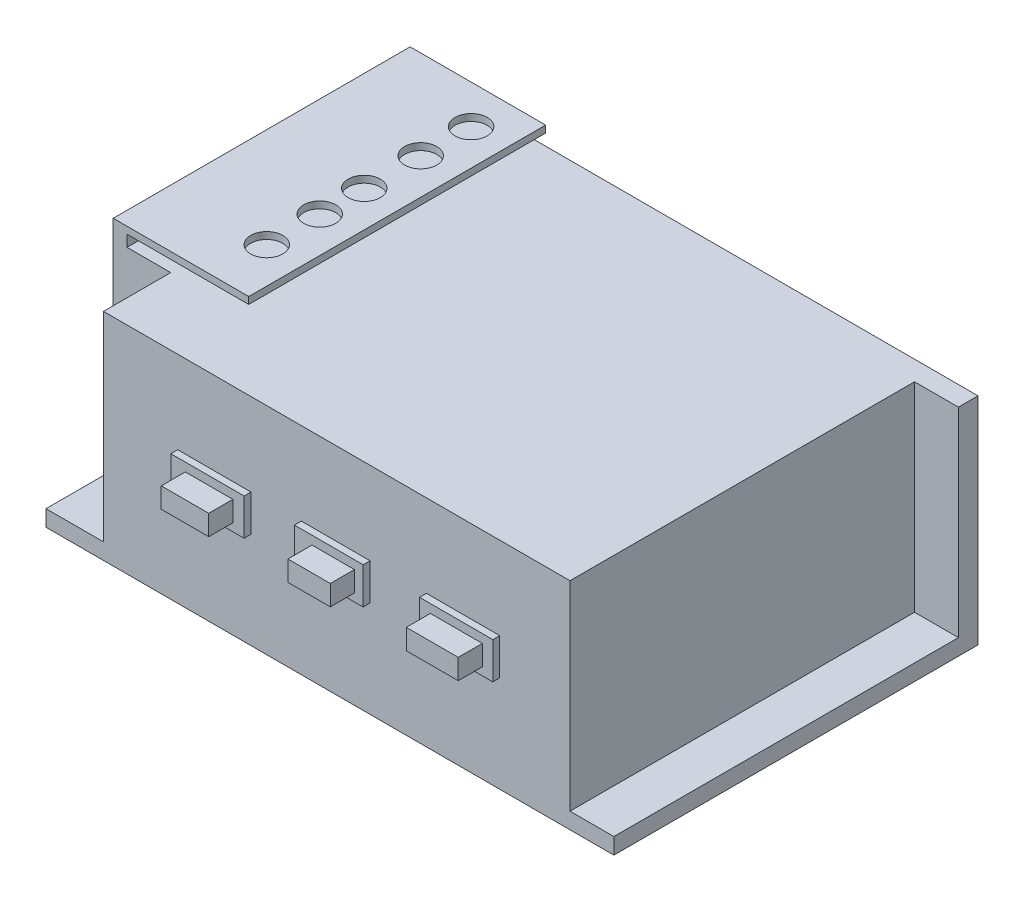
from build123d import *

# Parameters (mm, degrees)
SKETCH_1_W               = 165
SKETCH_1_H               = 68
EXTRUDE_1_DEPTH          = 105.8
SKETCH_2_W               = 39.381596793
SKETCH_2_H               = 19.528929346
SKETCH_2_W_2             = 20.130205532
CUT_EXTRUDE_1_DEPTH      = 2
SKETCH_3_R               = 4.669286721
CUT_EXTRUDE_2_DEPTH      = 2
SKETCH_4_W               = 21.280991735
SKETCH_4_H               = 10.640495868
SKETCH_4_W_2             = 19.950929752
EXTRUDE_2_DEPTH          = 2
SKETCH_5_W               = 13.799393078
SKETCH_5_H               = 5.887741047
SKETCH_5_W_2             = 12.327457817
SKETCH_5_W_3             = 15.087336432
EXTRUDE_3_DEPTH          = 7
SKETCH_6_W               = 105.8
SKETCH_6_H               = 3.312578262
CUT_EXTRUDE_3_DEPTH      = 161
CUT_EXTRUDE_4_DEPTH      = 58
CUT_EXTRUDE_4_DEPTH_BACK = 58
SKETCH_7_W               = 16.710317156
SKETCH_7_H               = 19.528929346
SKETCH_8_W               = 20.11053719
SKETCH_8_H               = 105.021694215
CUT_EXTRUDE_5_DEPTH      = 58


with BuildPart() as part:
    # 草图1 → 凸台-拉伸1 (new body)
    with BuildSketch(Plane.XY):
        Rectangle(SKETCH_1_W, SKETCH_1_H)
    extrude(amount=EXTRUDE_1_DEPTH)

    # 草图2 → 切除-拉伸1 (cut)
    with BuildSketch(Plane(origin=(0, 34, 0), x_dir=(1, 0, 0), z_dir=(0, 1, 0))):
        with Locations((-62.809201604, -96.035535327)):
            Rectangle(SKETCH_2_W, SKETCH_2_H)
        with Locations((-33.053300441, -96.035535327)):
            Rectangle(SKETCH_2_W_2, SKETCH_2_H)
        Polygon((82.5, 0), (-43.118403207, 0), (-43.118403207, -86.271070654), (-22.988197675, -86.271070654), (-22.988197675, -105.8), (82.5, -105.8), align=None)
    extrude(amount=-CUT_EXTRUDE_1_DEPTH, mode=Mode.SUBTRACT)

    # 草图3 → 切除-拉伸2 (cut)
    with BuildSketch(Plane(origin=(0, 34, 0), x_dir=(1, 0, 0), z_dir=(0, 1, 0))):
        with Locations(Location((-53.556287556, -11.217711758, 0), (0, 0, 270))):
            Circle(SKETCH_3_R)
        with Locations(Location((-53.556287556, -25.880454059, 0), (0, 0, 270))):
            Circle(SKETCH_3_R)
        with Locations(Location((-53.556287556, -42.282843752, 0), (0, 0, 270))):
            Circle(SKETCH_3_R)
        with Locations(Location((-53.556287556, -55.205938661, 0), (0, 0, 270))):
            Circle(SKETCH_3_R)
        with Locations(Location((-53.556287556, -70.61424413, 0), (0, 0, 270))):
            Circle(SKETCH_3_R)
    extrude(amount=-CUT_EXTRUDE_2_DEPTH, mode=Mode.SUBTRACT)

    # 草图4 → 凸台-拉伸2 (add)
    with BuildSketch(Plane.XY.offset(105.8)):
        with Locations((-33.584065083, -0.665030992)):
            Rectangle(SKETCH_4_W, SKETCH_4_H)
        with Locations((1.662577479, -0.665030992)):
            Rectangle(SKETCH_4_W_2, SKETCH_4_H)
        with Locations((38.68263602, -0.665030992)):
            Rectangle(SKETCH_4_W, SKETCH_4_H)
    extrude(amount=EXTRUDE_2_DEPTH)

    # 草图5 → 凸台-拉伸3 (add)
    with BuildSketch(Plane.XY.offset(107.8)):
        with Locations((-33.115606168, -0.77221182)):
            Rectangle(SKETCH_5_W, SKETCH_5_H)
        with Locations((2.946807743, -0.77221182)):
            Rectangle(SKETCH_5_W_2, SKETCH_5_H)
        with Locations((38.733233794, -0.77221182)):
            Rectangle(SKETCH_5_W_3, SKETCH_5_H)
    extrude(amount=EXTRUDE_3_DEPTH)

    # 草图6 → 切除-拉伸3 (cut)
    with BuildSketch(Plane(origin=(82.5, 0, 0), x_dir=(0, 0, -1), z_dir=(1, 0, 0))):
        with Locations((-52.9, 30.343710869)):
            Rectangle(SKETCH_6_W, SKETCH_6_H)
    extrude(amount=-CUT_EXTRUDE_3_DEPTH, mode=Mode.SUBTRACT)

    # 草图7 → 切除-拉伸4 (cut, two sides: drawn at the far end of the back side and taken through both)
    with BuildSketch(Plane(origin=(0, 28.687421738, 0), x_dir=(1, 0, 0), z_dir=(0, 1, 0)).offset(-CUT_EXTRUDE_4_DEPTH_BACK)):
        with Locations((-74.144841422, -96.035535327)):
            Rectangle(SKETCH_7_W, SKETCH_7_H)
    extrude(amount=CUT_EXTRUDE_4_DEPTH + CUT_EXTRUDE_4_DEPTH_BACK, mode=Mode.SUBTRACT)

    # 草图8 → 切除-拉伸5 (cut)
    with BuildSketch(Plane(origin=(0, 28.687421738, 0), x_dir=(1, 0, 0), z_dir=(0, 1, 0))):
        with Locations((79.803719008, -58.198037191)):
            Rectangle(SKETCH_8_W, SKETCH_8_H)
    extrude(amount=-CUT_EXTRUDE_5_DEPTH, mode=Mode.SUBTRACT)


solid = part.part
